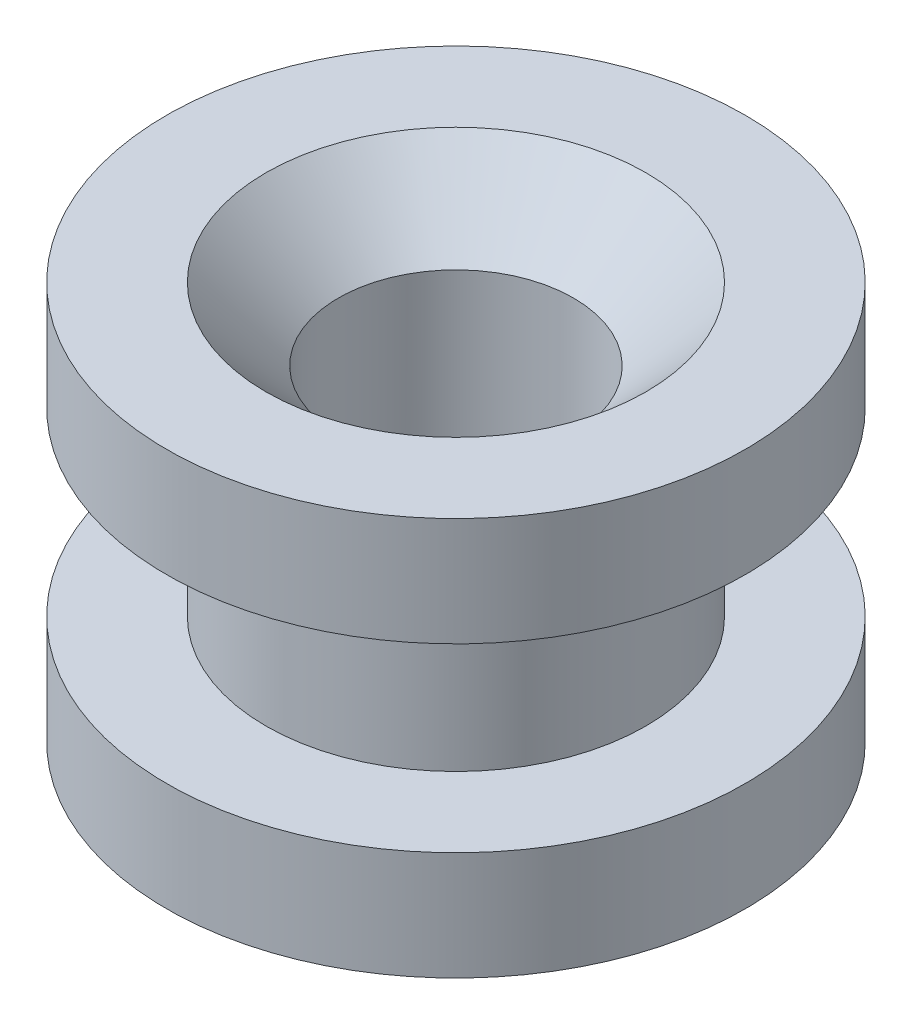
from build123d import *

# Parameters (mm, degrees)
CHAMFER1_SIZE = 2


with BuildPart() as part:
    # Sketch1 → Revolve1 (revolve)
    with BuildSketch(Plane.XY, mode=Mode.PRIVATE) as revolve1_sk:
        Polygon((3.25, 0), (3.25, 11), (8, 11), (8, 8), (5.25, 8), (5.25, 3), (8, 3), (8, 0), align=None)
    revolve(revolve1_sk.sketch.rotate(Axis((0, 0, 0), (0, 1, 0)), 90), axis=Axis((0, 0, 0), (0, 1, 0)))

    # Chamfer1
    chamfer1_edges = [part.edges().sort_by_distance(p)[0] for p in [
        (0, 0, 3.25),
        (0, 11, 3.25),
    ]]
    chamfer(chamfer1_edges, length=CHAMFER1_SIZE)


solid = part.part
